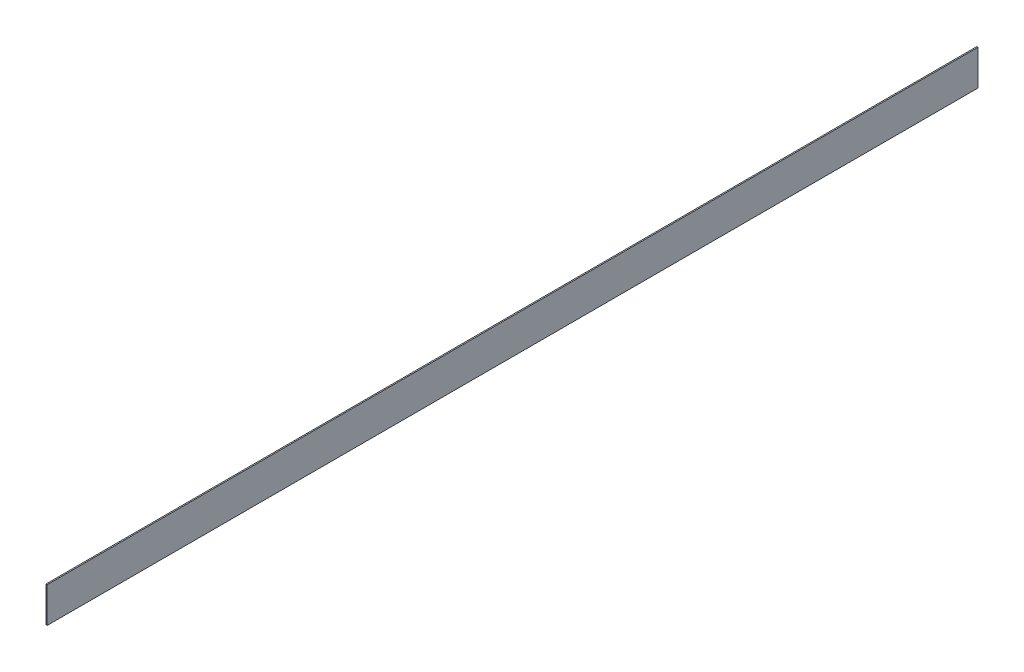
from build123d import *

# Parameters (mm, degrees)
SKETCH1_W           = 395
SKETCH1_H           = 15
BOSS_EXTRUDE1_DEPTH = 0.25


with BuildPart() as part:
    # Sketch1 → Boss-Extrude1 (new, symmetric)
    with BuildSketch(Plane(origin=(0, 0, 0), x_dir=(0, 0, -1), z_dir=(1, 0, 0))):
        Rectangle(SKETCH1_W, SKETCH1_H)
    extrude(amount=BOSS_EXTRUDE1_DEPTH, both=True)


solid = part.part
